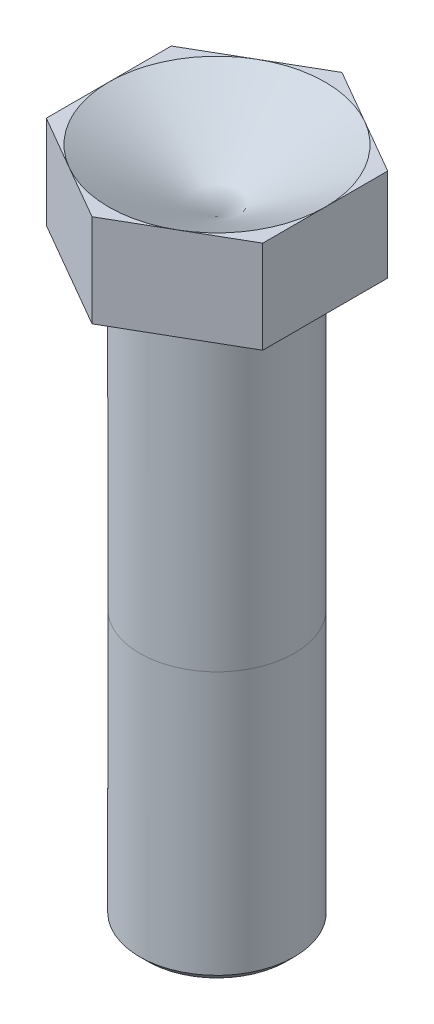
from build123d import *

# Parameters (mm, degrees)
BOSS_EXTRUDE1_DEPTH = 12
SKETCH3_R           = 10
BOSS_EXTRUDE2_DEPTH = 75
CHAMFER1_SIZE       = 1


with BuildPart() as part:
    # Sketch1 → Boss-Extrude1 (new body)
    with BuildSketch(Plane(origin=(0, 0, 0), x_dir=(1, 0, 0), z_dir=(0, 1, 0))):
        Polygon((14, 8.082903769), (0, 16.165807537), (-14, 8.082903769), (-14, -8.082903769), (0, -16.165807537), (14, -8.082903769), align=None)
    extrude(amount=BOSS_EXTRUDE1_DEPTH)

    # Cut-Extrude1 cone 1 section (through the dimple's axis) → Cut-Extrude1 (revolve, cut)
    with BuildSketch(Plane(origin=(0, 12, 0), x_dir=(0, 0, 1), z_dir=(1, 0, 0))):
        Polygon((0, 0), (14, 0), (0, 8.082903769), align=None)
    revolve(axis=Axis((0, 12, 0), (0, -1, 0)), mode=Mode.SUBTRACT)

    # Sketch3 → Boss-Extrude2 (add)
    with BuildSketch(Plane.XZ):
        with Locations(Location((0, 0, 0), (0, 0, 270))):
            Circle(SKETCH3_R)
    extrude(amount=BOSS_EXTRUDE2_DEPTH)

    # Chamfer1
    chamfer1_edges = [part.edges().sort_by_distance(p)[0] for p in [
        (0, -75, 10),
    ]]
    chamfer(chamfer1_edges, length=CHAMFER1_SIZE)


solid = part.part
